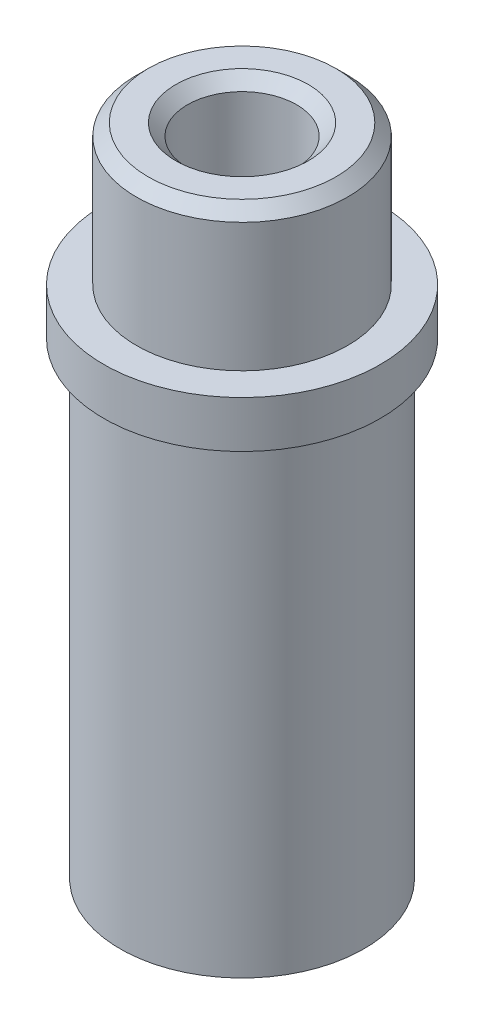
from build123d import *

# Parameters (mm, degrees)
CHAMFER1_SIZE = 0.381


with BuildPart() as part:
    # Sketch1 → Revolve1 (revolve)
    with BuildSketch(Plane.XY):
        Polygon((-1.778, 1.595281863), (-3.4417, 1.595281863), (-3.4417, -2.976718137), (-4.5085, -2.976718137), (-4.5085, -4.500718137), (-3.9751, -4.500718137), (-3.9751, -19.740718137), (0, -19.740718137), (0, -11.104718137), (-1.778, -11.104718137), align=None)
    revolve(axis=Axis((0, -11.104718137, 0), (0, 1, 0)))

    # Chamfer1
    chamfer1_edges = [part.edges().sort_by_distance(p)[0] for p in [
        (3.4417, 1.595281863, 0),
        (1.778, 1.595281863, 0),
    ]]
    chamfer(chamfer1_edges, length=CHAMFER1_SIZE)


solid = part.part
